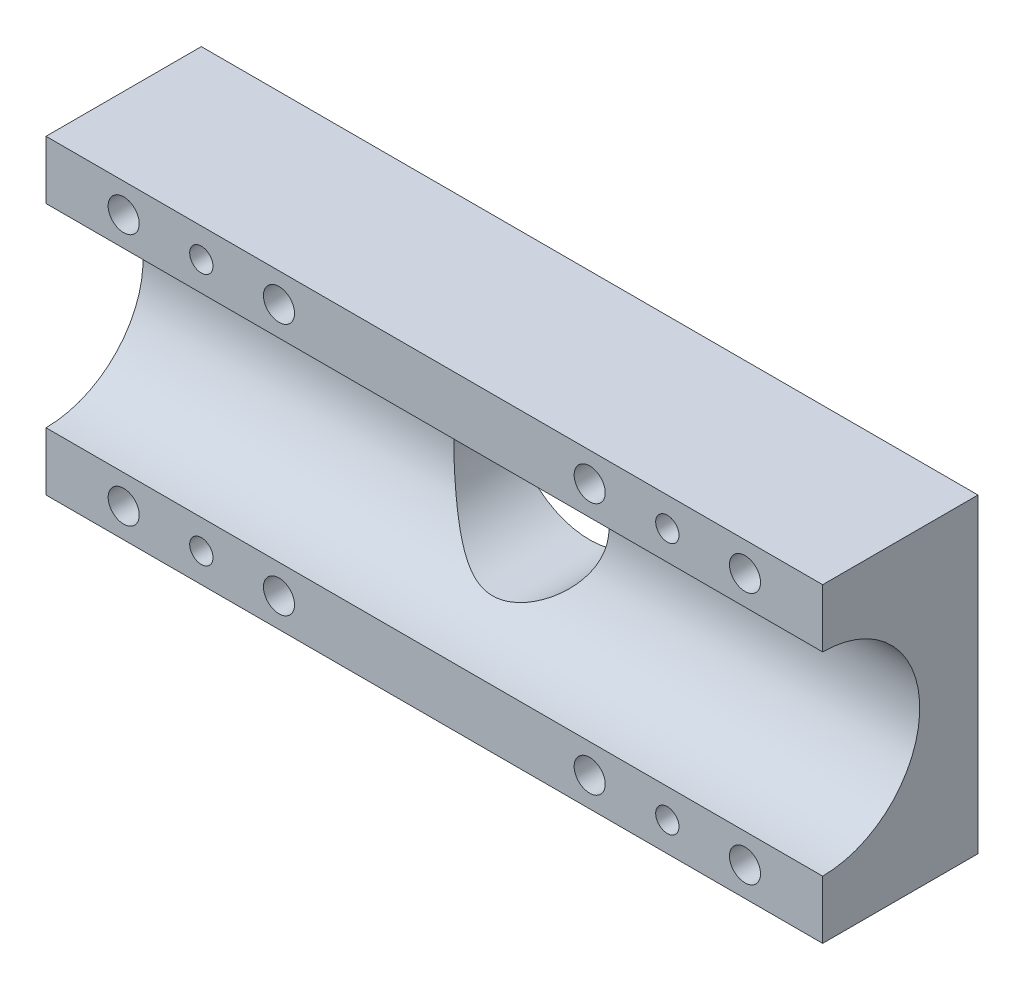
from build123d import *

# Parameters (mm, degrees)
SKETCH1_W           = 100
SKETCH1_H           = 40
BOSS_EXTRUDE2_DEPTH = 20
SKETCH3_R           = 12.5
CUT_EXTRUDE1_DEPTH  = 100
SKETCH4_R           = 2
SKETCH4_R_2         = 1.5
CUT_EXTRUDE2_DEPTH  = 20
SKETCH5_R           = 10
CUT_EXTRUDE3_DEPTH  = 20


with BuildPart() as part:
    # Sketch1 → Boss-Extrude2 (new body)
    with BuildSketch(Plane.XY):
        Rectangle(SKETCH1_W, SKETCH1_H)
    extrude(amount=BOSS_EXTRUDE2_DEPTH)

    # Sketch3 → Cut-Extrude1 (cut)
    with BuildSketch(Plane(origin=(50, 0, 0), x_dir=(0, 0, -1), z_dir=(1, 0, 0))):
        with Locations((-20, 0)):
            Circle(SKETCH3_R)
    extrude(amount=-CUT_EXTRUDE1_DEPTH, mode=Mode.SUBTRACT)

    # Sketch4 → Cut-Extrude2 (cut)
    with BuildSketch(Plane.XY.offset(20)):
        with Locations((-20, 16.25)):
            Circle(SKETCH4_R)
        with Locations((-30, 16.25)):
            Circle(SKETCH4_R_2)
        with Locations((-40, 16.25)):
            Circle(SKETCH4_R)
        with Locations((30, 16.25)):
            Circle(SKETCH4_R_2)
        with Locations((40, 16.25)):
            Circle(SKETCH4_R)
        with Locations((20, 16.25)):
            Circle(SKETCH4_R)
        with Locations((-40, -16.25)):
            Circle(SKETCH4_R)
        with Locations((-30, -16.25)):
            Circle(SKETCH4_R_2)
        with Locations((-20, -16.25)):
            Circle(SKETCH4_R)
        with Locations((20, -16.25)):
            Circle(SKETCH4_R)
        with Locations((30, -16.25)):
            Circle(SKETCH4_R_2)
        with Locations((40, -16.25)):
            Circle(SKETCH4_R)
    extrude(amount=-CUT_EXTRUDE2_DEPTH, mode=Mode.SUBTRACT)

    # Sketch5 → Cut-Extrude3 (cut)
    with BuildSketch(Plane(origin=(0, 0, 0), x_dir=(-1, 0, 0), z_dir=(0, 0, -1))):
        Circle(SKETCH5_R)
    extrude(amount=-CUT_EXTRUDE3_DEPTH, mode=Mode.SUBTRACT)


solid = part.part
